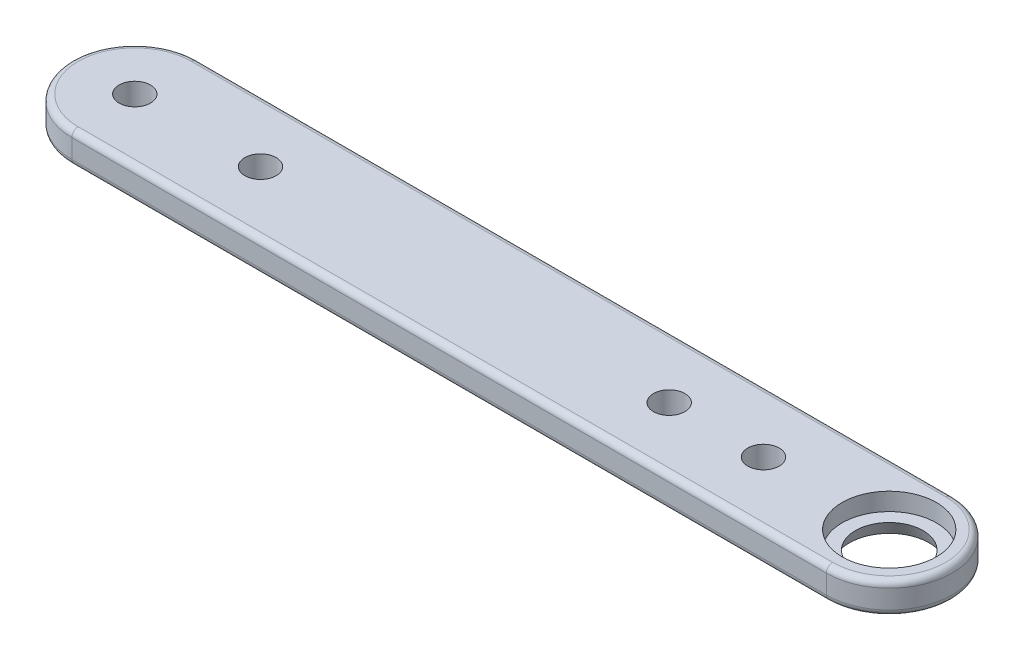
from build123d import *

# Parameters (mm, degrees)
SKETCH1_W           = 177.8
SKETCH1_H           = 25.4
BOSS_EXTRUDE1_DEPTH = 6.35
SKETCH2_R           = 3.175
SKETCH2_R_2         = 6.35
CUT_EXTRUDE1_DEPTH  = 91.02678768
SKETCH3_R           = 9.525
CUT_EXTRUDE2_DEPTH  = 3.571875
SKETCH4_R           = 3.175
CUT_EXTRUDE3_DEPTH  = 91.02678768
CUT_EXTRUDE4_DEPTH  = 91.02678768
FILLET1_R           = 1.27


with BuildPart() as part:
    # Sketch1 → Boss-Extrude1 (new body)
    with BuildSketch(Plane(origin=(0, 0, 0), x_dir=(1, 0, 0), z_dir=(0, 1, 0))):
        Rectangle(SKETCH1_W, SKETCH1_H)
    extrude(amount=BOSS_EXTRUDE1_DEPTH)

    # Sketch2 → Cut-Extrude1 (cut, through all)
    with BuildSketch(Plane(origin=(0, 6.35, 0), x_dir=(1, 0, 0), z_dir=(0, 1, 0))):
        with Locations(Location((-76.2, 0, 0), (0, 0, 270))):
            Circle(SKETCH2_R)
        with Locations(Location((76.2, 0, 0), (0, 0, 270))):
            Circle(SKETCH2_R_2)
        with Locations(Location((-50.8, 0, 0), (0, 0, 270))):
            Circle(SKETCH2_R)
    extrude(amount=-CUT_EXTRUDE1_DEPTH, mode=Mode.SUBTRACT)

    # Sketch3 → Cut-Extrude2 (cut)
    with BuildSketch(Plane(origin=(0, 6.35, 0), x_dir=(1, 0, 0), z_dir=(0, 1, 0))):
        with Locations(Location((76.2, 0, 0), (0, 0, 270))):
            Circle(SKETCH3_R)
    extrude(amount=-CUT_EXTRUDE2_DEPTH, mode=Mode.SUBTRACT)

    # Sketch4 → Cut-Extrude3 (cut, through all)
    with BuildSketch(Plane(origin=(0, 6.35, 0), x_dir=(1, 0, 0), z_dir=(0, 1, 0))):
        with Locations(Location((50.8, 0, 0), (0, 0, 270))):
            Circle(SKETCH4_R)
        with Locations(Location((31.75, 0, 0), (0, 0, 270))):
            Circle(SKETCH4_R)
    extrude(amount=-CUT_EXTRUDE3_DEPTH, mode=Mode.SUBTRACT)

    # Sketch5 → Cut-Extrude4 (cut, through all)
    with BuildSketch(Plane(origin=(0, 6.35, 0), x_dir=(1, 0, 0), z_dir=(0, 1, 0))):
        with BuildLine():
            Line((88.9, 12.7), (76.2, 12.7))
            ThreePointArc((76.2, 12.7), (85.180256121, 8.980256121), (88.9, 0))
            Line((88.9, 0), (88.9, 12.7))
        make_face()
        with BuildLine():
            ThreePointArc((88.9, 0), (85.180256121, -8.980256121), (76.2, -12.7))
            Line((76.2, -12.7), (88.9, -12.7))
            Line((88.9, -12.7), (88.9, 0))
        make_face()
        with BuildLine():
            ThreePointArc((-88.9, 0), (-85.180256121, 8.980256121), (-76.2, 12.7))
            Line((-76.2, 12.7), (-88.9, 12.7))
            Line((-88.9, 12.7), (-88.9, 0))
        make_face()
        with BuildLine():
            Line((-88.9, -12.7), (-76.2, -12.7))
            ThreePointArc((-76.2, -12.7), (-85.180256121, -8.980256121), (-88.9, 0))
            Line((-88.9, 0), (-88.9, -12.7))
        make_face()
    extrude(amount=-CUT_EXTRUDE4_DEPTH, mode=Mode.SUBTRACT)

    # Fillet1
    fillet1_edges = [part.edges().sort_by_distance(p)[0] for p in [
        (0, 0, -12.7),
        (0, 0, 12.7),
        (0, 6.35, 12.7),
        (0, 6.35, -12.7),
        (88.9, 6.35, 0),
        (88.9, 0, 0),
        (-88.9, 6.35, 0),
        (-88.9, 0, 0),
    ]]
    fillet(fillet1_edges, radius=FILLET1_R)

    # Sketch6 → Cut-Revolve2 (revolve, cut)
    with BuildSketch(Plane.ZY.offset(-76.2)):
        Polygon((-8.06821119, 0), (-6.35, 0), (-6.35, 2.778125), (-6.831310248, 2.778125), align=None)
    revolve(axis=Axis((76.2, 0, 0), (0, 1, 0)), mode=Mode.SUBTRACT)


solid = part.part
